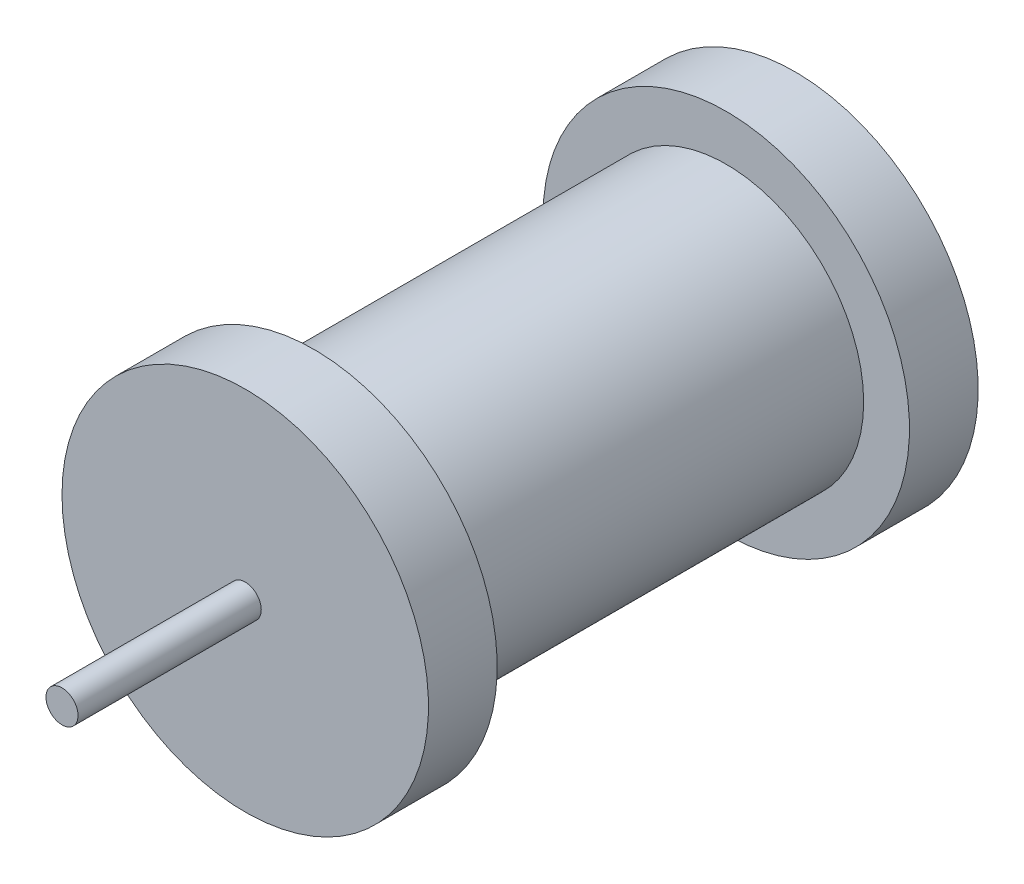
from build123d import *

# Parameters (mm, degrees)
SKETCH2_W = 1.75
SKETCH2_H = 20


with BuildPart() as part:
    # Sketch1 → Revolve1 (revolve)
    with BuildSketch(Plane(origin=(0, 0, 0), x_dir=(1, 0, 0), z_dir=(0, 1, 0)), mode=Mode.PRIVATE) as revolve1_sk:
        Polygon((15, 30), (20, 30), (20, 22.5), (15, 22.5), (15, -22.5), (20, -22.5), (20, -30), (15, -30), (0, -30), (0, 30), align=None)
    revolve(revolve1_sk.sketch.rotate(Axis((0, 0, -30), (0, 0, 1)), 180), axis=Axis((0, 0, -30), (0, 0, 1)))


with BuildPart() as body_2:
    # Sketch2 → Revolve2 (revolve)
    with BuildSketch(Plane(origin=(0, 0, 0), x_dir=(1, 0, 0), z_dir=(0, 1, 0))):
        with Locations((0.875, -40)):
            Rectangle(SKETCH2_W, SKETCH2_H)
    revolve(axis=Axis((0, 0, 8.040665434), (0, 0, -1)))


solid = Compound([part.part, body_2.part])
